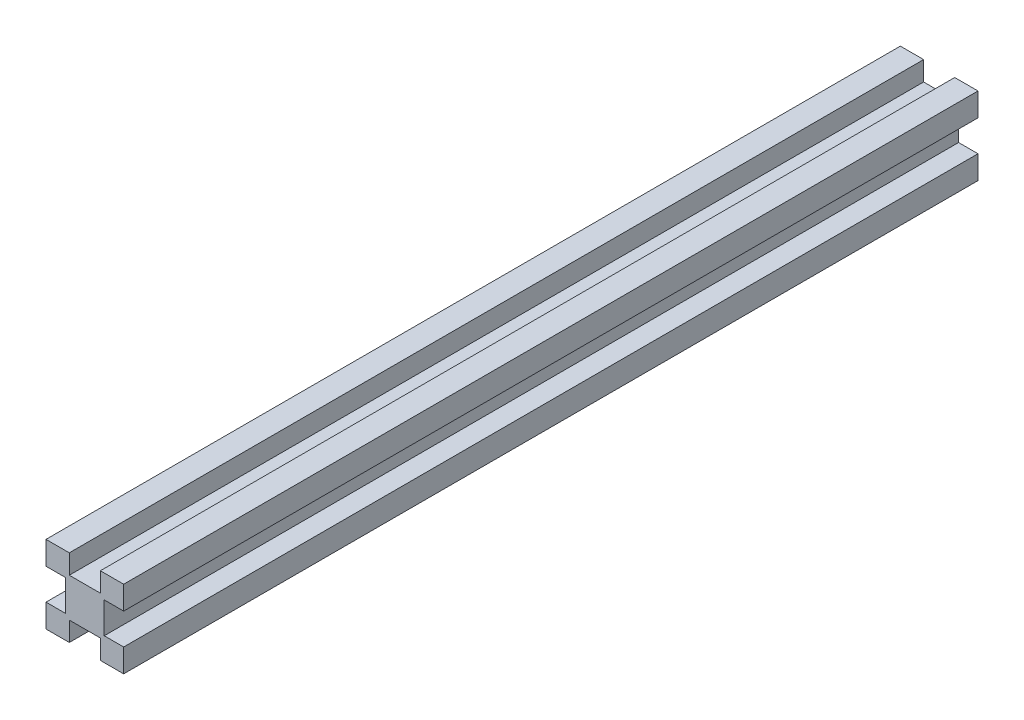
from build123d import *

# Parameters (mm, degrees)
CROQUIS1_W              = 20
CROQUIS1_H              = 20
SALIENTE_EXTRUIR1_DEPTH = 220
CORTAR_EXTRUIR1_DEPTH   = 320


with BuildPart() as part:
    # Croquis1 → Saliente-Extruir1 (new body)
    with BuildSketch(Plane.XY):
        with Locations((-13.532555049, 4.541666667)):
            Rectangle(CROQUIS1_W, CROQUIS1_H)
    extrude(amount=SALIENTE_EXTRUIR1_DEPTH)

    # Croquis2 → Cortar-Extruir1 (cut)
    with BuildSketch(Plane.XY.offset(220)):
        Polygon((-13.532555049, 9.541666667), (-17.532555049, 9.541666667), (-17.532555049, 14.541666667), (-9.532555049, 14.541666667), (-9.532555049, 9.541666667), align=None)
        Polygon((-9.532555049, -0.458333333), (-9.532555049, -5.458333333), (-17.532555049, -5.458333333), (-17.532555049, -0.458333333), (-13.532555049, -0.458333333), align=None)
        Polygon((-23.532555049, 4.541666667), (-23.532555049, 8.541666667), (-18.532555049, 8.541666667), (-18.532555049, 0.541666667), (-23.532555049, 0.541666667), align=None)
        Polygon((-8.532555049, 8.541666667), (-8.532555049, 0.541666667), (-3.532555049, 0.541666667), (-3.532555049, 4.541666667), (-3.532555049, 8.541666667), align=None)
    extrude(amount=-CORTAR_EXTRUIR1_DEPTH, mode=Mode.SUBTRACT)


solid = part.part
